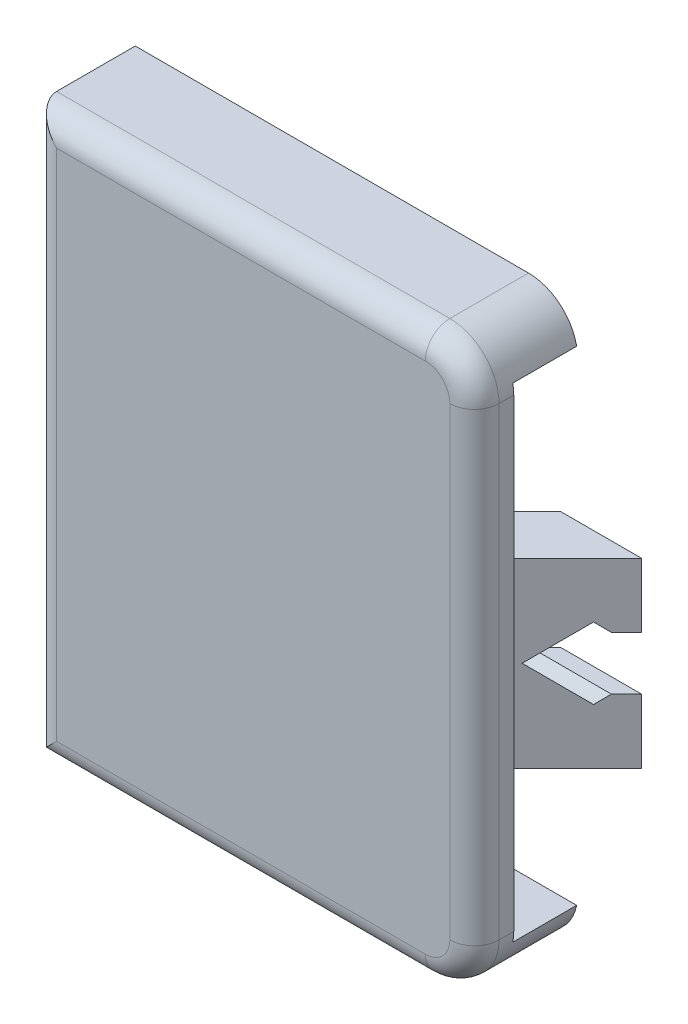
from build123d import *

# Parameters (mm, degrees)
SKETCH1_W               = 3.3
SKETCH1_H               = 7.4
SKETCH1_W_2             = 18
SKETCH1_H_2             = 1.6
BOSS_EXTRUDE1_DEPTH     = 2.6
SKETCH3_W               = 18
SKETCH3_H               = 22.9
BOSS_EXTRUDE2_DEPTH     = 1.6
CUT_EXTRUDE1_DEPTH      = 27.511924597
CUT_EXTRUDE1_DEPTH_BACK = 27.511924597
FILLET1_R               = 2
FILLET2_R               = 1
BOSS_EXTRUDE3_DEPTH     = 5
CUT_EXTRUDE2_DEPTH      = 10


with BuildPart() as part:
    # Sketch1 → Boss-Extrude1 (new body)
    with BuildSketch(Plane.XY):
        with Locations((0.442709082, -7.556371191)):
            Rectangle(SKETCH1_W, SKETCH1_H)
        with Locations((7.792709082, -7.556371191)):
            Rectangle(SKETCH1_W, SKETCH1_H)
        with Locations((0.442709082, 3.093628809)):
            Rectangle(SKETCH1_W_2, SKETCH1_H_2)
        with Locations((0.442709082, -18.206371191)):
            Rectangle(SKETCH1_W_2, SKETCH1_H_2)
        with Locations((0.442709082, -7.556371191)):
            Rectangle(SKETCH1_W_2, SKETCH1_H)
    extrude(amount=BOSS_EXTRUDE1_DEPTH)

    # Sketch3 → Boss-Extrude2 (add)
    with BuildSketch(Plane.XY.offset(2.6)):
        with Locations((0.442709082, -7.556371191)):
            Rectangle(SKETCH3_W, SKETCH3_H)
    extrude(amount=BOSS_EXTRUDE2_DEPTH)

    # Sketch4 → Cut-Extrude1 (cut, two sides: drawn at the far end of the back side and taken through both)
    with BuildSketch(Plane.ZY.offset(8.557290918).offset(-CUT_EXTRUDE1_DEPTH_BACK)):
        Polygon((1.342435563, -8.644254243), (0.613371363, -8.644254243), (0.977903463, -9.008786343), align=None)
        Polygon((2.430318615, -7.556371191), (1.342435563, -6.468488139), (1.342435563, -8.644254243), align=None)
        Polygon((0.977903463, -6.103956039), (0.613371363, -6.468488139), (1.342435563, -6.468488139), align=None)
        Polygon((0.613371363, -6.468488139), (0, -7.081859502), (0, -8.03088288), (0.613371363, -8.644254243), (1.342435563, -8.644254243), (1.342435563, -6.468488139), align=None)
        Polygon((0, -6.468488139), (0, -7.081859502), (0.613371363, -6.468488139), align=None)
        Polygon((0.613371363, -8.644254243), (0, -8.03088288), (0, -8.644254243), align=None)
    extrude(amount=CUT_EXTRUDE1_DEPTH + CUT_EXTRUDE1_DEPTH_BACK, mode=Mode.SUBTRACT)

    # Fillet1
    fillet1_edges = [part.edges().sort_by_distance(p)[0] for p in [
        (9.442709082, 3.893628809, 2.1),
        (9.442709082, -19.006371191, 2.1),
    ]]
    fillet(fillet1_edges, radius=FILLET1_R)

    # Fillet2
    fillet2_edges = [part.edges().sort_by_distance(p)[0] for p in [
        (9.442709082, -7.556371191, 4.2),
        (8.856922645, -18.420584754, 4.2),
        (8.856922645, 3.307842371, 4.2),
        (-8.557290918, -7.556371191, 4.2),
        (-0.557290918, -19.006371191, 4.2),
        (-0.557290918, 3.893628809, 4.2),
    ]]
    fillet(fillet2_edges, radius=FILLET2_R)

    # Sketch6 → Boss-Extrude3 (add)
    with BuildSketch(Plane(origin=(9.442709082, 0, 0), x_dir=(0, 0, -1), z_dir=(1, 0, 0))):
        Polygon((-2.6, -3.856371191), (-2.6, -11.256371191), (0, -11.256371191), (0, -8.644254243), (-0.613371363, -8.644254243), (-0.977903463, -9.008786343), (-2.430318615, -7.556371191), (-0.977903463, -6.103956039), (-0.613371363, -6.468488139), (0, -6.468488139), (0, -3.856371191), align=None)
    extrude(amount=BOSS_EXTRUDE3_DEPTH)

    # Sketch5 → Cut-Extrude2 (cut)
    with BuildSketch(Plane.XZ.offset(11.256371191)):
        Polygon((-5.257290918, 2.6), (-1.207290918, 2.6), (1.809394507, -0.416685424), (-2.240605493, -0.416685424), align=None)
        Polygon((2.092709082, 2.6), (6.142709082, 2.6), (10.446710416, -1.704001333), (6.396710416, -1.704001333), align=None)
        Polygon((-8.557290918, 2.6), (-13.200539382, 2.6), (-10.121786084, -0.478753297), (-5.47853762, -0.478753297), align=None)
        Polygon((9.442709082, 2.6), (15.456496685, 2.6), (19.467588869, -1.411092184), (13.453801266, -1.411092184), align=None)
    extrude(amount=-CUT_EXTRUDE2_DEPTH, mode=Mode.SUBTRACT)


solid = part.part
